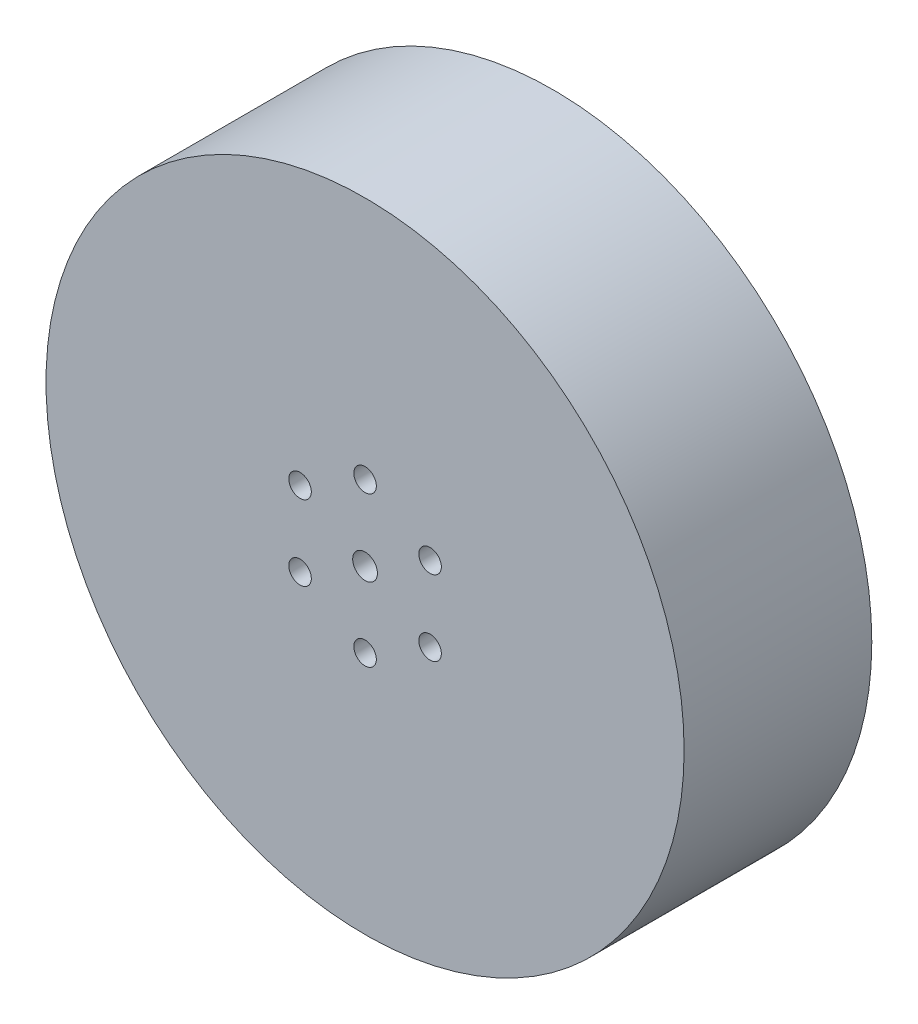
from build123d import *
from build123d.topology import SkipClean

# Parameters (mm, degrees)
SKETCH1_R             = 42.5
SKETCH1_R_2           = 14
SKETCH1_R_3           = 1.5
BOSS_EXTRUDE1_DEPTH   = 25
BOSS_EXTRUDE2_START   = 2
SKETCH2_R             = 14
SKETCH2_R_2           = 1.5
BOSS_EXTRUDE2_DEPTH   = 2
M4_TAPPED_HOLE1_D     = 3.3
M4_TAPPED_HOLE1_DEPTH = 5
M4_TAPPED_HOLE1_TIP   = 0.991420021


with BuildPart() as part:
    # Sketch1 → Boss-Extrude1 (new body)
    # profile 1 of 2: a face of its own
    with BuildSketch(Plane.XY):
        Circle(SKETCH1_R)
        Circle(SKETCH1_R_2, mode=Mode.SUBTRACT)
    # profile 2 of 2: a face of its own
    with BuildSketch(Plane.XY):
        Circle(SKETCH1_R_2)
        with Locations((-8.660254038, 5)):
            Circle(SKETCH1_R_3, mode=Mode.SUBTRACT)
        with Locations((-8.660254038, -5)):
            Circle(SKETCH1_R_3, mode=Mode.SUBTRACT)
        with Locations((0, -10)):
            Circle(SKETCH1_R_3, mode=Mode.SUBTRACT)
        with Locations((8.660254038, -5)):
            Circle(SKETCH1_R_3, mode=Mode.SUBTRACT)
        with Locations((8.660254038, 5)):
            Circle(SKETCH1_R_3, mode=Mode.SUBTRACT)
        with Locations((0, 10)):
            Circle(SKETCH1_R_3, mode=Mode.SUBTRACT)
    extrude(amount=BOSS_EXTRUDE1_DEPTH)

    # Sketch2 → Boss-Extrude2 (add)
    with SkipClean():  # the faces are left unmerged after this step: merging them gives an invalid solid
        with BuildSketch(Plane(origin=(0, 0, 0), x_dir=(-1, 0, 0), z_dir=(0, 0, -1)).offset(BOSS_EXTRUDE2_START)):
            with Locations(Location((0, 0, 0), (0, 0, 180))):
                Circle(SKETCH2_R)
            with Locations((0, 10)):
                Circle(SKETCH2_R_2, mode=Mode.SUBTRACT)
            with Locations((8.660254038, 5)):
                Circle(SKETCH2_R_2, mode=Mode.SUBTRACT)
            with Locations((8.660254038, -5)):
                Circle(SKETCH2_R_2, mode=Mode.SUBTRACT)
            with Locations((0, -10)):
                Circle(SKETCH2_R_2, mode=Mode.SUBTRACT)
            with Locations((-8.660254038, -5)):
                Circle(SKETCH2_R_2, mode=Mode.SUBTRACT)
            with Locations((-8.660254038, 5)):
                Circle(SKETCH2_R_2, mode=Mode.SUBTRACT)
        extrude(amount=-BOSS_EXTRUDE2_DEPTH)

    # M4 Tapped Hole1
    with Locations(Plane.XY.offset(25)):
        with Locations((0, 0)):
            Hole(M4_TAPPED_HOLE1_D / 2, depth=M4_TAPPED_HOLE1_DEPTH)
            with Locations((0, 0, -(M4_TAPPED_HOLE1_DEPTH + M4_TAPPED_HOLE1_TIP / 2))):  # 118° drill point
                Cone(0, M4_TAPPED_HOLE1_D / 2, M4_TAPPED_HOLE1_TIP, mode=Mode.SUBTRACT)


solid = part.part
